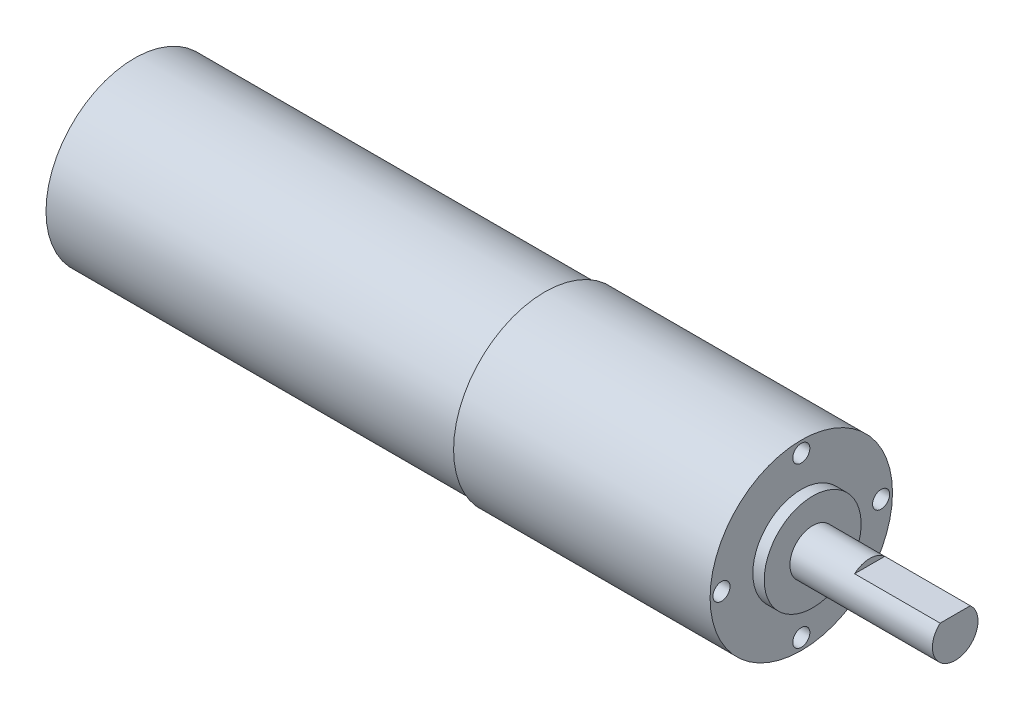
from build123d import *

# Parameters (mm, degrees)
CUT_EXTRUDE1_DEPTH = 15
SKETCH3_R          = 1.5
CUT_EXTRUDE2_DEPTH = 5


with BuildPart() as part:
    # Sketch1 → Revolve1 (revolve)
    with BuildSketch(Plane.XY, mode=Mode.PRIVATE) as revolve1_sk:
        Polygon((0, 0), (0, 15.5), (72, 15.5), (72, 16), (117, 16), (117, 8.5), (119, 8.5), (119, 4), (144, 4), (144, 0), align=None)
    revolve(revolve1_sk.sketch.rotate(Axis((0, 0, 0), (1, 0, 0)), 90), axis=Axis((0, 0, 0), (1, 0, 0)))

    # Sketch2 → Cut-Extrude1 (cut)
    with BuildSketch(Plane(origin=(144, 0, 0), x_dir=(0, 0, -1), z_dir=(1, 0, 0))):
        with BuildLine():
            Line((-2.645751311, 3), (2.645751311, 3))
            ThreePointArc((2.645751311, 3), (0, 4), (-2.645751311, 3))
        make_face()
    extrude(amount=-CUT_EXTRUDE1_DEPTH, mode=Mode.SUBTRACT)

    # Sketch3 → Cut-Extrude2 (cut)
    with BuildSketch(Plane(origin=(117, 0, 0), x_dir=(0, 0, -1), z_dir=(1, 0, 0))):
        with Locations((0, 14)):
            Circle(SKETCH3_R)
        with Locations((14, 0)):
            Circle(SKETCH3_R)
        with Locations((0, -14)):
            Circle(SKETCH3_R)
        with Locations((-14, 0)):
            Circle(SKETCH3_R)
    extrude(amount=-CUT_EXTRUDE2_DEPTH, mode=Mode.SUBTRACT)


solid = part.part
